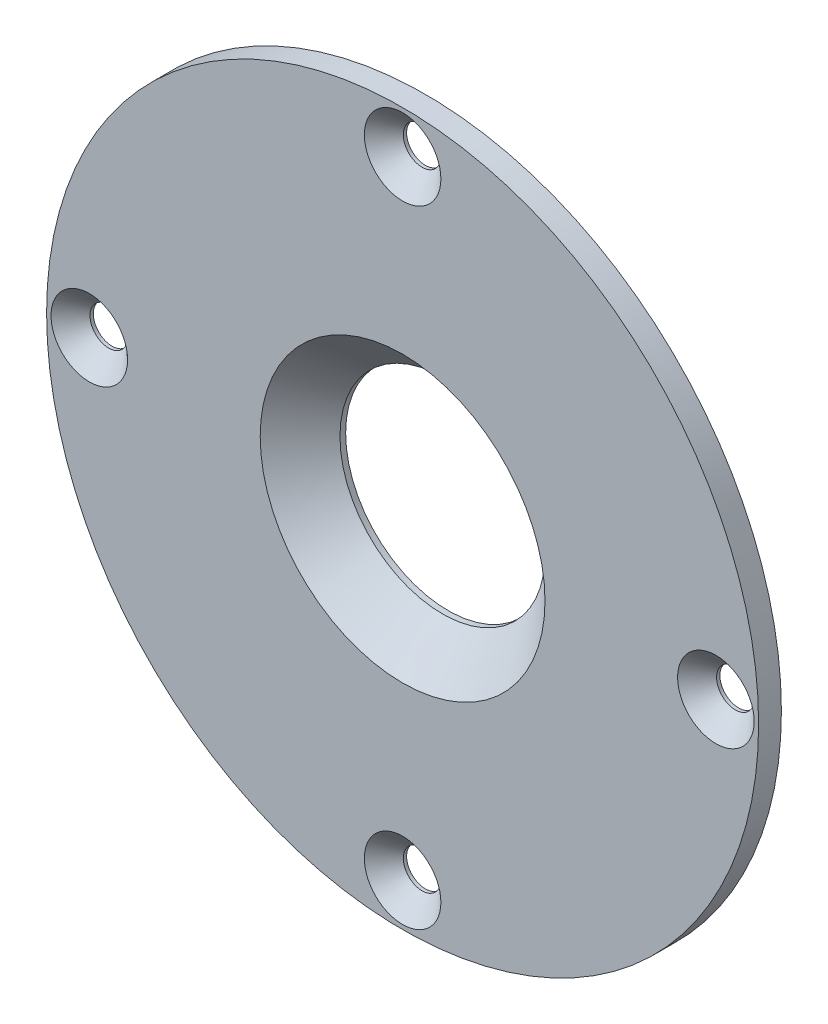
from build123d import *

# Parameters (mm, degrees)
POG_BIENIE_STO_KOWE_POD_M6_WKR_T_Z_BEM_D           = 6.6
POG_BIENIE_STO_KOWE_POD_M6_WKR_T_Z_BEM_DEPTH       = 30
POG_BIENIE_STO_KOWE_POD_M6_WKR_T_Z_BEM_CSINK_D     = 13.44
POG_BIENIE_STO_KOWE_POD_M6_WKR_T_Z_BEM_CSINK_ANGLE = 90
POG_BIENIE_STO_KOWE_POD_M6_WKR_T_Z_BEM_TIP         = 1.982840043


with BuildPart() as part:
    # Szkic2 → Obrót1 (revolve)
    with BuildSketch(Plane(origin=(0, 0, 0), x_dir=(1, 0, 0), z_dir=(0, 1, 0))):
        Polygon((0, 0), (45, 0), (45, -4), (62.5, -4), (62.5, -8), (0, -8), align=None)
    revolve(axis=Axis((0, 0, 8), (0, 0, -1)))

    # Szkic1 → Wycięcie-obrót1 (revolve, cut)
    with BuildSketch(Plane(origin=(0, 0, 0), x_dir=(1, 0, 0), z_dir=(0, 1, 0))):
        Polygon((0, 0), (18, 0), (18, -1), (25, -8), (0, -8), align=None)
    revolve(axis=Axis((0, 0, 8), (0, 0, -1)), mode=Mode.SUBTRACT)

    # Pogłębienie stożkowe pod M6 Wkręt z łbem stożkowym płaskim1
    with Locations(Plane(origin=(-55, 0, 8), x_dir=(1, 0, 0), z_dir=(0, 0, 1))):
        with Locations((0, 0), (55, 55), (110, 0), (55, -55)):
            CounterSinkHole(POG_BIENIE_STO_KOWE_POD_M6_WKR_T_Z_BEM_D / 2, POG_BIENIE_STO_KOWE_POD_M6_WKR_T_Z_BEM_CSINK_D / 2, depth=POG_BIENIE_STO_KOWE_POD_M6_WKR_T_Z_BEM_DEPTH, counter_sink_angle=POG_BIENIE_STO_KOWE_POD_M6_WKR_T_Z_BEM_CSINK_ANGLE)
            with Locations((0, 0, -(POG_BIENIE_STO_KOWE_POD_M6_WKR_T_Z_BEM_DEPTH + POG_BIENIE_STO_KOWE_POD_M6_WKR_T_Z_BEM_TIP / 2))):  # 118° drill point
                Cone(0, POG_BIENIE_STO_KOWE_POD_M6_WKR_T_Z_BEM_D / 2, POG_BIENIE_STO_KOWE_POD_M6_WKR_T_Z_BEM_TIP, mode=Mode.SUBTRACT)


solid = part.part
